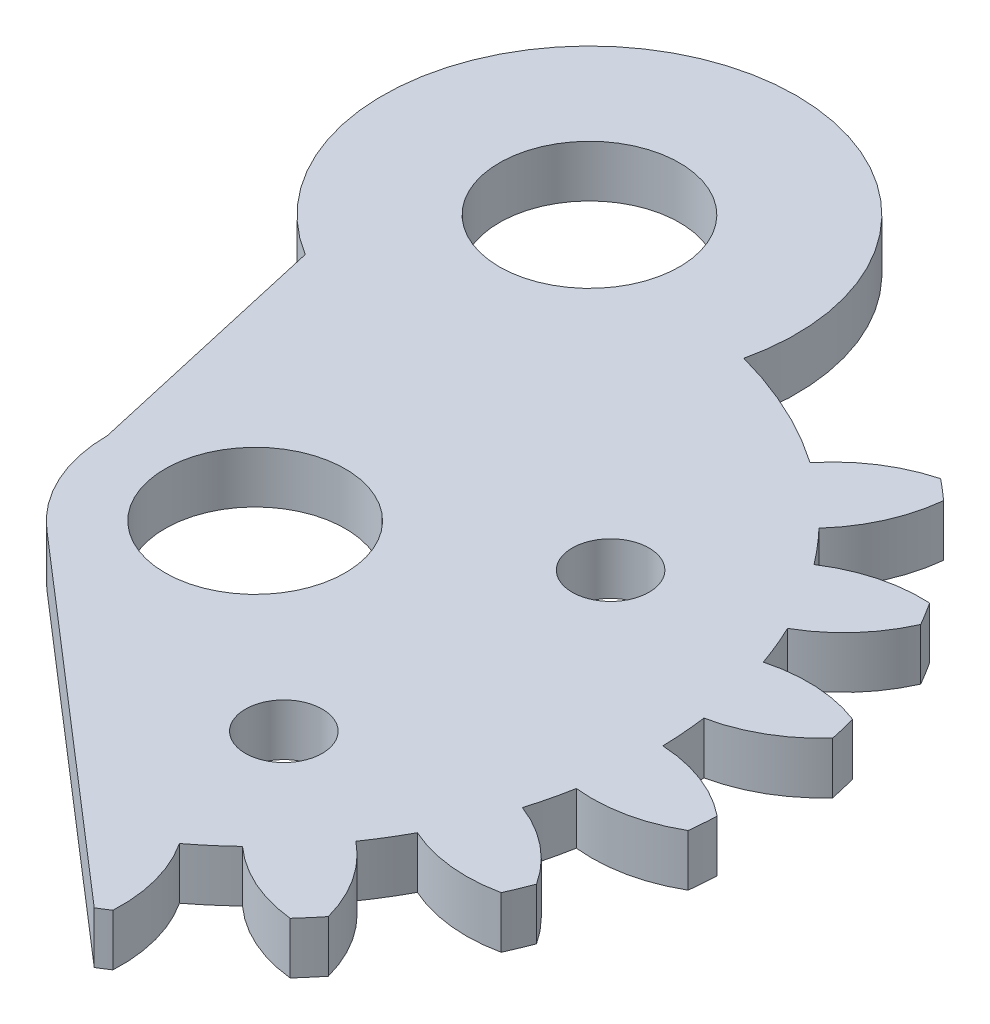
from build123d import *
from build123d.topology import SkipClean

# Parameters (mm, degrees)
SKETCH_1_R           = 27
EXTRUDE_2_DEPTH      = 10
EXTRUDE_START        = -10
EXTRUDE_3_DEPTH      = 10
CUT_EXTRUDE_2_DEPTH  = 48.669538272
SKETCH_6_R           = 6.1
CUT_EXTRUDE_3_DEPTH  = 10
EXTRUDE_5_DEPTH      = 10
SKETCH_10_R          = 6.1
CUT_EXTRUDE_5_DEPTH  = 10
CUT_EXTRUDE_START    = -10
CUT_EXTRUDE_6_DEPTH  = 10
FILLET_1_R           = 10
EXTRUDE_7_DEPTH      = 10
CUT_EXTRUDE_START_2  = -6.5
CUT_EXTRUDE_8_DEPTH  = 6.5
CUT_EXTRUDE_9_DEPTH  = 10
CUT_EXTRUDE_10_DEPTH = 10


with BuildPart() as part:
    # 草图1 → 凸台-拉伸2 (new body)
    with BuildSketch(Plane(origin=(0, 0, 0), x_dir=(1, 0, 0), z_dir=(0, 1, 0))):
        with Locations(Location((0, 0, 0), (0, 0, 270))):
            Circle(SKETCH_1_R)
    extrude(amount=EXTRUDE_2_DEPTH)

    # 草图3 → 凸台-拉伸3 (add)
    with BuildSketch(Plane(origin=(0, 10, 0), x_dir=(1, 0, 0), z_dir=(0, 1, 0)).offset(EXTRUDE_START)):
        with BuildLine():
            ThreePointArc((-3.623654542, 26.755730746), (-4.775668185, 29.776890365), (-6.810627033, 32.289554959))
            ThreePointArc((-6.810627033, 32.289554959), (-7.703697007, 32.088207373), (-8.590838072, 31.862164101))
            ThreePointArc((-8.590838072, 31.862164101), (-9.263273827, 28.699511571), (-8.918147734, 25.484635391))
            ThreePointArc((-8.918147734, 25.484635391), (-6.303024824, 26.253987851), (-3.623654542, 26.755730746))
        make_face()
        with BuildLine():
            ThreePointArc((-11.714275763, 24.326441239), (-13.743495509, 26.843742988), (-16.455312443, 28.604592156))
            ThreePointArc((-16.455312443, 28.604592156), (-17.242452636, 28.137125424), (-18.016322714, 27.648003832))
            ThreePointArc((-18.016322714, 27.648003832), (-17.678533741, 24.432348458), (-16.356847947, 21.481469346))
            ThreePointArc((-16.356847947, 21.481469346), (-14.107461247, 23.021284438), (-11.714275763, 24.326441239))
        make_face()
        with BuildLine():
            ThreePointArc((-18.658222053, 19.515910171), (-21.366013737, 21.282943016), (-24.48923722, 22.119612574))
            ThreePointArc((-24.48923722, 22.119612574), (-25.093396865, 21.431785595), (-25.678244161, 20.727464312))
            ThreePointArc((-25.678244161, 20.727464312), (-24.363295599, 17.773576848), (-22.194425918, 15.375547411))
            ThreePointArc((-22.194425918, 15.375547411), (-20.530961071, 17.535097305), (-18.658222053, 19.515910171))
        make_face()
        with BuildLine():
            ThreePointArc((-23.77577157, 12.79502584), (-26.897077674, 13.638820294), (-30.125984831, 13.469411196))
            ThreePointArc((-30.125984831, 13.469411196), (-30.488024573, 12.628553268), (-30.826600159, 11.777976169))
            ThreePointArc((-30.826600159, 11.777976169), (-28.663208335, 9.3750037), (-25.859458842, 7.764559768))
            ThreePointArc((-25.859458842, 7.764559768), (-24.944747378, 10.332452674), (-23.77577157, 12.79502584))
        make_face()
        with BuildLine():
            ThreePointArc((-26.56598291, 4.821675232), (-29.795268245, 4.659634815), (-32.813791147, 3.500730003))
            ThreePointArc((-32.813791147, 3.500730003), (-32.898272013, 2.589150159), (-32.957433752, 1.675577656))
            ThreePointArc((-32.957433752, 1.675577656), (-30.15736653, 0.05873987), (-26.993187762, -0.606477084))
            ThreePointArc((-26.993187762, -0.606477084), (-26.916768011, 2.118395585), (-26.56598291, 4.821675232))
        make_face()
        with BuildLine():
            ThreePointArc((-32.289554959, -6.810627033), (-32.088207373, -7.703697007), (-31.862164101, -8.590838072))
            ThreePointArc((-31.862164101, -8.590838072), (-28.699511571, -9.263273827), (-25.484635391, -8.918147734))
            ThreePointArc((-25.484635391, -8.918147734), (-26.253987851, -6.303024824), (-26.755730746, -3.623654542))
            ThreePointArc((-26.755730746, -3.623654542), (-29.776890365, -4.775668185), (-32.289554959, -6.810627033))
        make_face()
        with BuildLine():
            ThreePointArc((-28.604592156, -16.455312443), (-28.137125424, -17.242452636), (-27.648003832, -18.016322714))
            ThreePointArc((-27.648003832, -18.016322714), (-24.432348458, -17.678533741), (-21.481469346, -16.356847947))
            ThreePointArc((-21.481469346, -16.356847947), (-23.021284438, -14.107461247), (-24.326441239, -11.714275763))
            ThreePointArc((-24.326441239, -11.714275763), (-26.843742988, -13.743495509), (-28.604592156, -16.455312443))
        make_face()
        with BuildLine():
            ThreePointArc((-22.119612574, -24.48923722), (-21.431785595, -25.093396865), (-20.727464312, -25.678244161))
            ThreePointArc((-20.727464312, -25.678244161), (-17.773576848, -24.363295599), (-15.375547411, -22.194425918))
            ThreePointArc((-15.375547411, -22.194425918), (-17.535097305, -20.530961071), (-19.515910171, -18.658222053))
            ThreePointArc((-19.515910171, -18.658222053), (-21.282943016, -21.366013737), (-22.119612574, -24.48923722))
        make_face()
        with BuildLine():
            ThreePointArc((-13.469411196, -30.125984831), (-12.628553268, -30.488024573), (-11.777976169, -30.826600159))
            ThreePointArc((-11.777976169, -30.826600159), (-9.3750037, -28.663208335), (-7.764559768, -25.859458842))
            ThreePointArc((-7.764559768, -25.859458842), (-10.332452674, -24.944747378), (-12.79502584, -23.77577157))
            ThreePointArc((-12.79502584, -23.77577157), (-13.638820294, -26.897077674), (-13.469411196, -30.125984831))
        make_face()
        with BuildLine():
            ThreePointArc((-3.500730003, -32.813791147), (-2.589150159, -32.898272013), (-1.675577656, -32.957433752))
            ThreePointArc((-1.675577656, -32.957433752), (-0.05873987, -30.15736653), (0.606477084, -26.993187762))
            ThreePointArc((0.606477084, -26.993187762), (-2.118395585, -26.916768011), (-4.821675232, -26.56598291))
            ThreePointArc((-4.821675232, -26.56598291), (-4.659634815, -29.795268245), (-3.500730003, -32.813791147))
        make_face()
        with BuildLine():
            ThreePointArc((6.810627033, -32.289554959), (7.703697007, -32.088207373), (8.590838072, -31.862164101))
            ThreePointArc((8.590838072, -31.862164101), (9.263273827, -28.699511571), (8.918147734, -25.484635391))
            ThreePointArc((8.918147734, -25.484635391), (6.303024824, -26.253987851), (3.623654542, -26.755730746))
            ThreePointArc((3.623654542, -26.755730746), (4.775668185, -29.776890365), (6.810627033, -32.289554959))
        make_face()
        with BuildLine():
            ThreePointArc((16.455312443, -28.604592156), (17.242452636, -28.137125424), (18.016322714, -27.648003832))
            ThreePointArc((18.016322714, -27.648003832), (17.678533741, -24.432348458), (16.356847947, -21.481469346))
            ThreePointArc((16.356847947, -21.481469346), (14.107461247, -23.021284438), (11.714275763, -24.326441239))
            ThreePointArc((11.714275763, -24.326441239), (13.743495509, -26.843742988), (16.455312443, -28.604592156))
        make_face()
        with BuildLine():
            ThreePointArc((24.48923722, -22.119612574), (25.093396865, -21.431785595), (25.678244161, -20.727464312))
            ThreePointArc((25.678244161, -20.727464312), (24.363295599, -17.773576848), (22.194425918, -15.375547411))
            ThreePointArc((22.194425918, -15.375547411), (20.530961071, -17.535097305), (18.658222053, -19.515910171))
            ThreePointArc((18.658222053, -19.515910171), (21.366013737, -21.282943016), (24.48923722, -22.119612574))
        make_face()
        with BuildLine():
            ThreePointArc((30.125984831, -13.469411196), (30.488024573, -12.628553268), (30.826600159, -11.777976169))
            ThreePointArc((30.826600159, -11.777976169), (28.663208335, -9.3750037), (25.859458842, -7.764559768))
            ThreePointArc((25.859458842, -7.764559768), (24.944747378, -10.332452674), (23.77577157, -12.79502584))
            ThreePointArc((23.77577157, -12.79502584), (26.897077674, -13.638820294), (30.125984831, -13.469411196))
        make_face()
        with BuildLine():
            ThreePointArc((32.813791147, -3.500730003), (32.898272013, -2.589150159), (32.957433752, -1.675577656))
            ThreePointArc((32.957433752, -1.675577656), (30.15736653, -0.05873987), (26.993187762, 0.606477084))
            ThreePointArc((26.993187762, 0.606477084), (26.998296887, 0.303257671), (27, 0))
            ThreePointArc((27, 0), (26.891276825, -2.420584789), (26.56598291, -4.821675232))
            ThreePointArc((26.56598291, -4.821675232), (29.795268245, -4.659634815), (32.813791147, -3.500730003))
        make_face()
        with BuildLine():
            ThreePointArc((26.755730746, 3.623654542), (29.776890365, 4.775668185), (32.289554959, 6.810627033))
            ThreePointArc((32.289554959, 6.810627033), (32.088207373, 7.703697007), (31.862164101, 8.590838072))
            ThreePointArc((31.862164101, 8.590838072), (28.699511571, 9.263273827), (25.484635391, 8.918147734))
            ThreePointArc((25.484635391, 8.918147734), (26.253987851, 6.303024824), (26.755730746, 3.623654542))
        make_face()
        with BuildLine():
            ThreePointArc((24.326441239, 11.714275763), (26.843742988, 13.743495509), (28.604592156, 16.455312443))
            ThreePointArc((28.604592156, 16.455312443), (28.137125424, 17.242452636), (27.648003832, 18.016322714))
            ThreePointArc((27.648003832, 18.016322714), (24.432348458, 17.678533741), (21.481469346, 16.356847947))
            ThreePointArc((21.481469346, 16.356847947), (23.021284438, 14.107461247), (24.326441239, 11.714275763))
        make_face()
        with BuildLine():
            ThreePointArc((19.515910171, 18.658222053), (21.282943016, 21.366013737), (22.119612574, 24.48923722))
            ThreePointArc((22.119612574, 24.48923722), (21.431785595, 25.093396865), (20.727464312, 25.678244161))
            ThreePointArc((20.727464312, 25.678244161), (17.773576848, 24.363295599), (15.375547411, 22.194425918))
            ThreePointArc((15.375547411, 22.194425918), (17.535097305, 20.530961071), (19.515910171, 18.658222053))
        make_face()
        with BuildLine():
            ThreePointArc((12.79502584, 23.77577157), (13.638820294, 26.897077674), (13.469411196, 30.125984831))
            ThreePointArc((13.469411196, 30.125984831), (12.628553268, 30.488024573), (11.777976169, 30.826600159))
            ThreePointArc((11.777976169, 30.826600159), (9.3750037, 28.663208335), (7.764559768, 25.859458842))
            ThreePointArc((7.764559768, 25.859458842), (10.332452674, 24.944747378), (12.79502584, 23.77577157))
        make_face()
        with BuildLine():
            ThreePointArc((4.821675232, 26.56598291), (4.659634815, 29.795268245), (3.500730003, 32.813791147))
            ThreePointArc((3.500730003, 32.813791147), (2.589150159, 32.898272013), (1.675577656, 32.957433752))
            ThreePointArc((1.675577656, 32.957433752), (0.05873987, 30.15736653), (-0.606477084, 26.993187762))
            ThreePointArc((-0.606477084, 26.993187762), (2.118395585, 26.916768011), (4.821675232, 26.56598291))
        make_face()
    extrude(amount=EXTRUDE_3_DEPTH)

    # 草图4 → 切除-拉伸2 (cut, through all)
    with BuildSketch(Plane(origin=(0, 10, 0), x_dir=(1, 0, 0), z_dir=(0, 1, 0))):
        with BuildLine():
            Line((68.70942434, -72.656830422), (-6.542169106, -7.563069707))
            ThreePointArc((-6.542169106, -7.563069707), (-9.614988938, -2.748088014), (-9.550796477, 2.963492306))
            Line((-9.550796477, 2.963492306), (-2.118395585, 26.916768011))
            Line((-2.118395585, 26.916768011), (19.935579671, 97.992717399))
            ThreePointArc((19.935579671, 97.992717399), (-96.149889375, -27.480880138), (68.70942434, -72.656830422))
        make_face()
    extrude(amount=-CUT_EXTRUDE_2_DEPTH, mode=Mode.SUBTRACT)

    # 草图6 → 切除-拉伸3 (cut)
    with BuildSketch(Plane(origin=(0, 10, 0), x_dir=(1, 0, 0), z_dir=(0, 1, 0))):
        with Locations(Location((0, 0, 0), (0, 0, 270))):
            Circle(SKETCH_6_R)
    extrude(amount=-CUT_EXTRUDE_3_DEPTH, mode=Mode.SUBTRACT)

    # 草图9 → 凸台-拉伸5 (add)
    with BuildSketch(Plane(origin=(0, 10, 0), x_dir=(1, 0, 0), z_dir=(0, 1, 0)).offset(EXTRUDE_START)):
        with BuildLine():
            Line((-18.337271569, 36.810995995), (-10, 0))
            ThreePointArc((-10, 0), (-9.887061363, 1.49867195), (-9.550796477, 2.963492306))
            Line((-9.550796477, 2.963492306), (-2.118395585, 26.916768011))
            ThreePointArc((-2.118395585, 26.916768011), (-1.362972032, 26.965576338), (-0.606477084, 26.993187762))
            ThreePointArc((-0.606477084, 26.993187762), (0.05873987, 30.15736653), (1.675577656, 32.957433752))
            ThreePointArc((1.675577656, 32.957433752), (2.589150159, 32.898272013), (3.500730003, 32.813791147))
            ThreePointArc((3.500730003, 32.813791147), (4.659634815, 29.795268245), (4.821675232, 26.56598291))
            Line((4.821675232, 26.56598291), (7.168022985, 33.612773021))
            ThreePointArc((7.168022985, 33.612773021), (-5.303969741, 37.450057719), (-18.337271569, 36.810995995))
        make_face()
    extrude(amount=EXTRUDE_5_DEPTH)

    # 草图10 → 切除-拉伸5 (cut)
    with BuildSketch(Plane(origin=(0, 10, 0), x_dir=(1, 0, 0), z_dir=(0, 1, 0))):
        with Locations(Location((-6.626815852, 29.258935587, 0), (0, 0, 270))):
            Circle(SKETCH_10_R)
    extrude(amount=-CUT_EXTRUDE_5_DEPTH, mode=Mode.SUBTRACT)

    # 草图11 → 切除-拉伸6 (cut)
    with BuildSketch(Plane(origin=(0, 10, 0), x_dir=(1, 0, 0), z_dir=(0, 1, 0)).offset(CUT_EXTRUDE_START)):
        with BuildLine():
            Line((0, 36.394498532), (3.500730003, 32.813791147))
            ThreePointArc((3.500730003, 32.813791147), (4.659634815, 29.795268245), (4.821675232, 26.56598291))
            Line((4.821675232, 26.56598291), (7.168022985, 33.612773021))
            ThreePointArc((7.168022985, 33.612773021), (3.655030847, 35.186640305), (0, 36.394498532))
        make_face()
    extrude(amount=CUT_EXTRUDE_6_DEPTH, mode=Mode.SUBTRACT)

    # 圆角1
    fillet_1_edges = [part.edges().sort_by_distance(p)[0] for p in [
        (-18.337271569, 5, -36.810995995),
    ]]
    fillet(fillet_1_edges, radius=FILLET_1_R)

    # 草图16 → 凸台-拉伸7 (add)
    with BuildSketch(Plane(origin=(0, 10, 0), x_dir=(1, 0, 0), z_dir=(0, 1, 0)).offset(EXTRUDE_START)):
        with BuildLine():
            Line((-13.920244702, 17.308793512), (-15.716384779, 25.239170332))
            ThreePointArc((-15.716384779, 25.239170332), (-13.300434171, 34.242814336), (-4.508428545, 37.341694744))
            ThreePointArc((-4.508428545, 37.341694744), (-2.23974925, 36.936946702), (0, 36.394498532))
            Line((0, 36.394498532), (3.500730003, 32.813791147))
            ThreePointArc((3.500730003, 32.813791147), (4.659634815, 29.795268245), (4.821675232, 26.56598291))
            ThreePointArc((4.821675232, 26.56598291), (5.919103569, 26.343200507), (7.006350229, 26.075104151))
            ThreePointArc((7.006350229, 26.075104151), (7.281173311, 27.65648826), (7.373184148, 29.258935587))
            ThreePointArc((7.373184148, 29.258935587), (-13.478530824, 41.467703008), (-13.920244702, 17.308793512))
        make_face()
    extrude(amount=EXTRUDE_7_DEPTH)

    # 草图17 → 切除-拉伸8 (cut)
    with BuildSketch(Plane(origin=(0, 10, 0), x_dir=(1, 0, 0), z_dir=(0, 1, 0)).offset(CUT_EXTRUDE_START_2)):
        with BuildLine():
            Line((-13.920244702, 17.308793512), (-10, 0))
            ThreePointArc((-10, 0), (-9.09455032, -4.158022904), (-6.542169106, -7.563069707))
            Line((-6.542169106, -7.563069707), (17.242452636, -28.137125424))
            ThreePointArc((17.242452636, -28.137125424), (17.631083908, -27.895248345), (18.016322714, -27.648003832))
            ThreePointArc((18.016322714, -27.648003832), (17.678533741, -24.432348458), (16.356847947, -21.481469346))
            ThreePointArc((16.356847947, -21.481469346), (17.535097305, -20.530961071), (18.658222053, -19.515910171))
            ThreePointArc((18.658222053, -19.515910171), (21.366013737, -21.282943016), (24.48923722, -22.119612574))
            ThreePointArc((24.48923722, -22.119612574), (25.093396865, -21.431785595), (25.678244161, -20.727464312))
            ThreePointArc((25.678244161, -20.727464312), (24.363295599, -17.773576848), (22.194425918, -15.375547411))
            ThreePointArc((22.194425918, -15.375547411), (23.021284438, -14.107461247), (23.77577157, -12.79502584))
            ThreePointArc((23.77577157, -12.79502584), (26.897077674, -13.638820294), (30.125984831, -13.469411196))
            ThreePointArc((30.125984831, -13.469411196), (30.488024573, -12.628553268), (30.826600159, -11.777976169))
            ThreePointArc((30.826600159, -11.777976169), (28.663208335, -9.3750037), (25.859458842, -7.764559768))
            ThreePointArc((25.859458842, -7.764559768), (26.253987851, -6.303024824), (26.56598291, -4.821675232))
            ThreePointArc((26.56598291, -4.821675232), (29.795268245, -4.659634815), (32.813791147, -3.500730003))
            ThreePointArc((32.813791147, -3.500730003), (32.898272013, -2.589150159), (32.957433752, -1.675577656))
            ThreePointArc((32.957433752, -1.675577656), (30.15736653, -0.05873987), (26.993187762, 0.606477084))
            ThreePointArc((26.993187762, 0.606477084), (26.916768011, 2.118395585), (26.755730746, 3.623654542))
            ThreePointArc((26.755730746, 3.623654542), (29.776890365, 4.775668185), (32.289554959, 6.810627033))
            ThreePointArc((32.289554959, 6.810627033), (32.088207373, 7.703697007), (31.862164101, 8.590838072))
            ThreePointArc((31.862164101, 8.590838072), (28.699511571, 9.263273827), (25.484635391, 8.918147734))
            ThreePointArc((25.484635391, 8.918147734), (24.944747378, 10.332452674), (24.326441239, 11.714275763))
            ThreePointArc((24.326441239, 11.714275763), (26.843742988, 13.743495509), (28.604592156, 16.455312443))
            ThreePointArc((28.604592156, 16.455312443), (28.137125424, 17.242452636), (27.648003832, 18.016322714))
            ThreePointArc((27.648003832, 18.016322714), (24.432348458, 17.678533741), (21.481469346, 16.356847947))
            ThreePointArc((21.481469346, 16.356847947), (20.530961071, 17.535097305), (19.515910171, 18.658222053))
            ThreePointArc((19.515910171, 18.658222053), (21.282943016, 21.366013737), (22.119612574, 24.48923722))
            ThreePointArc((22.119612574, 24.48923722), (21.431785595, 25.093396865), (20.727464312, 25.678244161))
            ThreePointArc((20.727464312, 25.678244161), (17.773576848, 24.363295599), (15.375547411, 22.194425918))
            ThreePointArc((15.375547411, 22.194425918), (14.107461247, 23.021284438), (12.79502584, 23.77577157))
            ThreePointArc((12.79502584, 23.77577157), (13.638820294, 26.897077674), (13.469411196, 30.125984831))
            ThreePointArc((13.469411196, 30.125984831), (12.628553268, 30.488024573), (11.777976169, 30.826600159))
            ThreePointArc((11.777976169, 30.826600159), (9.3750037, 28.663208335), (7.764559768, 25.859458842))
            ThreePointArc((7.764559768, 25.859458842), (7.386242025, 25.970048686), (7.006350229, 26.075104151))
            ThreePointArc((7.006350229, 26.075104151), (-12.036078056, 42.171715396), (-13.920244702, 17.308793512))
        make_face()
    extrude(amount=CUT_EXTRUDE_8_DEPTH, mode=Mode.SUBTRACT)

    # 草图19 → 切除-拉伸9 (cut)
    with BuildSketch(Plane(origin=(0, 3.5, 0), x_dir=(1, 0, 0), z_dir=(0, 1, 0))):
        with BuildLine():
            ThreePointArc((17.521202876, 9.143724883), (17.423586491, 9.849470052), (17.138067304, 10.502221151))
            Line((17.138067304, 10.502221151), (14.921202876, 9.143724883))
            ThreePointArc((14.921202876, 9.143724883), (15.559223715, 8.01002855), (16.111264261, 6.832068788))
            ThreePointArc((16.111264261, 6.832068788), (17.140905514, 7.78987105), (17.521202876, 9.143724883))
        make_face()
        with BuildLine():
            Line((14.921202876, 9.143724883), (17.138067304, 10.502221151))
            ThreePointArc((17.138067304, 10.502221151), (15.433773338, 11.692699485), (13.401778777, 11.253547246))
            ThreePointArc((13.401778777, 11.253547246), (14.200727447, 10.226892977), (14.921202876, 9.143724883))
        make_face()
        with BuildLine():
            ThreePointArc((16.111264261, 6.832068788), (15.559223715, 8.01002855), (14.921202876, 9.143724883))
            Line((14.921202876, 9.143724883), (12.704338449, 7.785228614))
            ThreePointArc((12.704338449, 7.785228614), (14.220696248, 6.639869762), (16.111264261, 6.832068788))
        make_face()
        with BuildLine():
            Line((12.704338449, 7.785228614), (14.921202876, 9.143724883))
            ThreePointArc((14.921202876, 9.143724883), (14.200727447, 10.226892977), (13.401778777, 11.253547246))
            ThreePointArc((13.401778777, 11.253547246), (12.372228274, 9.656295344), (12.704338449, 7.785228614))
        make_face()
        with BuildLine():
            ThreePointArc((11.330048887, -9.67677592), (10.709328217, -11.472853236), (11.476337998, -13.211497499))
            ThreePointArc((11.476337998, -13.211497499), (12.426054396, -12.322466156), (13.307104398, -11.365340846))
            Line((13.307104398, -11.365340846), (11.330048887, -9.67677592))
        make_face()
        with BuildLine():
            ThreePointArc((13.307104398, -11.365340846), (12.426054396, -12.322466156), (11.476337998, -13.211497499))
            ThreePointArc((11.476337998, -13.211497499), (13.414616788, -13.963117027), (15.284159909, -13.053905771))
            Line((15.284159909, -13.053905771), (13.307104398, -11.365340846))
        make_face()
        with BuildLine():
            ThreePointArc((14.844136837, -9.268311689), (13.006911405, -8.782728957), (11.330048887, -9.67677592))
            Line((11.330048887, -9.67677592), (13.307104398, -11.365340846))
            ThreePointArc((13.307104398, -11.365340846), (14.114619321, -10.345410645), (14.844136837, -9.268311689))
        make_face()
        with BuildLine():
            ThreePointArc((15.907104398, -11.365340846), (15.626186581, -10.189816354), (14.844136837, -9.268311689))
            ThreePointArc((14.844136837, -9.268311689), (14.114619321, -10.345410645), (13.307104398, -11.365340846))
            Line((13.307104398, -11.365340846), (15.284159909, -13.053905771))
            ThreePointArc((15.284159909, -13.053905771), (15.746401871, -12.265245194), (15.907104398, -11.365340846))
        make_face()
    extrude(amount=-CUT_EXTRUDE_9_DEPTH, mode=Mode.SUBTRACT)

    # 草图20 → 切除-拉伸10 (cut)
    with SkipClean():  # the faces are left unmerged after this step: merging them gives an invalid solid
        with BuildSketch(Plane(origin=(0, 3.5, 0), x_dir=(1, 0, 0), z_dir=(0, 1, 0)).offset(CUT_EXTRUDE_START)):
            with BuildLine():
                ThreePointArc((11.777976169, 30.826600159), (9.3750037, 28.663208335), (7.764559768, 25.859458842))
                ThreePointArc((7.764559768, 25.859458842), (10.332452674, 24.944747378), (12.79502584, 23.77577157))
                ThreePointArc((12.79502584, 23.77577157), (13.638820294, 26.897077674), (13.469411196, 30.125984831))
                ThreePointArc((13.469411196, 30.125984831), (12.628553268, 30.488024573), (11.777976169, 30.826600159))
            make_face()
        extrude(amount=CUT_EXTRUDE_10_DEPTH, mode=Mode.SUBTRACT)


solid = part.part
